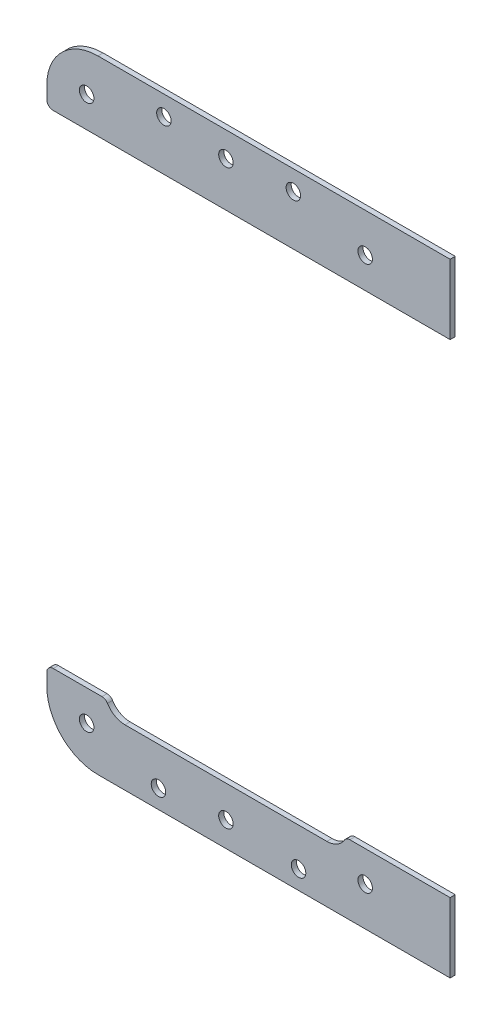
from build123d import *

# Parameters (mm, degrees)
SKETCH2_W            = 111.125
SKETCH2_H            = 193.04
BOSS_EXTRUDE1_DEPTH  = 1.5875
M4_CLEARANCE_HOLE1_D = 4.5
FILLET1_R            = 15.875
SKETCH6_R            = 2.4003
SKETCH6_R_2          = 3
SKETCH6_R_3          = 6.477
SKETCH6_R_4          = 10.762
CUT_EXTRUDE1_DEPTH   = 212.192646736
SKETCH7_W            = 13.97
SKETCH7_H            = 193.04
BOSS_EXTRUDE2_DEPTH  = 1.5875
SKETCH8_W            = 75.32443897
SKETCH8_H            = 38.1
SKETCH8_R            = 10.762
SKETCH8_R_2          = 3
SKETCH8_H_2          = 31.75
SKETCH8_H_3          = 34.487219484
SKETCH8_R_3          = 2.4003
SKETCH8_R_4          = 6.477
SKETCH8_R_5          = 8.9535
CUT_EXTRUDE2_DEPTH   = 1.5875
FILLET2_R            = 9.525
FILLET3_R            = 6.35
FILLET4_R            = 9.525
SKETCH9_W            = 125.095
SKETCH9_H            = 149.86
CUT_EXTRUDE5_DEPTH   = 80
FILLET6_R            = 2
FILLET8_R            = 2
FILLET9_R            = 2
FILLET10_R           = 2
SKETCH17_R           = 2.25
CUT_EXTRUDE12_DEPTH  = 72.5925
SKETCH18_R           = 2.25
BOSS_EXTRUDE9_DEPTH  = 1.5875
SKETCH20_R           = 2.25
CUT_EXTRUDE18_DEPTH  = 17.5875


with BuildPart() as part:
    # Sketch2 → Boss-Extrude1 (new body)
    with BuildSketch(Plane.XY.offset(-401.504104662)):
        with Locations((-6.650833159, 105.295051609)):
            Rectangle(SKETCH2_W, SKETCH2_H)
    extrude(amount=BOSS_EXTRUDE1_DEPTH)

    # M4 Clearance Hole1 (through all)
    with Locations(Plane.XY.offset(-399.916604662)):
        with Locations((36.540537091, 189.761421859), (-6.650833159, 194.079751609), (-49.842203409, 189.761421859), (-54.160533159, 133.489051609), (-54.160533159, 77.101051609), (-49.842203409, 20.82868136), (-6.650833159, 16.510351609), (36.540537091, 20.82868136), (40.858866841, 77.101051609), (40.858866841, 133.489051609), (14.260079544, 195.670051609), (-55.750833159, 105.295051609), (-27.561745863, 14.920051609)):
            Hole(M4_CLEARANCE_HOLE1_D / 2)

    # Fillet1
    fillet1_edges = [part.edges().sort_by_distance(p)[0] for p in [
        (-62.213333159, 201.815051609, -400.710354662),
        (-62.213333159, 8.775051609, -400.710354662),
    ]]
    fillet(fillet1_edges, radius=FILLET1_R)

    # Sketch6 → Cut-Extrude1 (cut, through all)
    with BuildSketch(Plane.XY.offset(-399.916604662)):
        with Locations((-34.590833159, 43.382551609)):
            Circle(SKETCH6_R)
        with Locations((21.289166841, 43.382551609)):
            Circle(SKETCH6_R)
        with Locations((-20.884724927, 142.590766631)):
            Circle(SKETCH6_R_2)
        with Locations((7.583058609, 166.225175879)):
            Circle(SKETCH6_R_2)
        with Locations((3.509166841, 43.382551609)):
            Circle(SKETCH6_R_3)
        with Locations((-16.810833159, 43.382551609)):
            Circle(SKETCH6_R_3)
        with Locations((-33.320833159, 123.670051609)):
            Circle(SKETCH6_R_3)
        with Locations((-6.650833159, 154.407971255)):
            Circle(SKETCH6_R_4)
        with Locations((-6.650833159, 94.607131964)):
            Circle(SKETCH6_R_4)
    extrude(amount=-CUT_EXTRUDE1_DEPTH, mode=Mode.SUBTRACT)

    # Sketch7 → Boss-Extrude2 (add)
    with BuildSketch(Plane.XY.offset(-399.916604662)):
        with Locations((55.896666841, 105.295051609)):
            Rectangle(SKETCH7_W, SKETCH7_H)
    extrude(amount=-BOSS_EXTRUDE2_DEPTH)

    # Sketch8 → Cut-Extrude2 (cut)
    # profile 1 of 4: a face of its own
    with BuildSketch(Plane.XY.offset(-399.916604662)):
        with Locations((-6.650833159, 154.407971255)):
            Rectangle(SKETCH8_W, SKETCH8_H)
        with Locations((-6.650833159, 154.407971255)):
            Circle(SKETCH8_R, mode=Mode.SUBTRACT)
        with Locations((7.583058609, 166.225175879)):
            Circle(SKETCH8_R_2, mode=Mode.SUBTRACT)
        with Locations((-20.884724927, 142.590766631)):
            Circle(SKETCH8_R_2, mode=Mode.SUBTRACT)
    # profile 2 of 4: a face of its own
    with BuildSketch(Plane.XY.offset(-399.916604662)):
        with Locations((-6.650833159, 94.607131964)):
            Rectangle(SKETCH8_W, SKETCH8_H_2)
        with Locations((-6.650833159, 94.607131964)):
            Circle(SKETCH8_R, mode=Mode.SUBTRACT)
    # profile 3 of 4: a face of its own
    with BuildSketch(Plane.XY.offset(-399.916604662)):
        with Locations((-6.650833159, 43.601441867)):
            Rectangle(SKETCH8_W, SKETCH8_H_3)
        with Locations((-34.590833159, 43.382551609)):
            Circle(SKETCH8_R_3, mode=Mode.SUBTRACT)
        with Locations((-16.810833159, 43.382551609)):
            Circle(SKETCH8_R_4, mode=Mode.SUBTRACT)
        with Locations((3.509166841, 43.382551609)):
            Circle(SKETCH8_R_4, mode=Mode.SUBTRACT)
        with Locations((21.289166841, 43.382551609)):
            Circle(SKETCH8_R_3, mode=Mode.SUBTRACT)
    # profile 4 of 4: a face of its own
    with BuildSketch(Plane.XY.offset(-399.916604662)):
        with Locations((-33.320833159, 123.670051609)):
            Circle(SKETCH8_R_5)
        with Locations((-33.320833159, 123.670051609)):
            Circle(SKETCH8_R_4, mode=Mode.SUBTRACT)
    extrude(amount=-CUT_EXTRUDE2_DEPTH, mode=Mode.SUBTRACT)

    # Fillet2
    fillet2_edges = [part.edges().sort_by_distance(p)[0] for p in [
        (-44.313052644, 173.457971255, -400.710354662),
        (-44.313052644, 135.357971255, -400.710354662),
        (31.011386326, 135.357971255, -400.710354662),
        (31.011386326, 173.457971255, -400.710354662),
    ]]
    fillet(fillet2_edges, radius=FILLET2_R)

    # Fillet3
    fillet3_edges = [part.edges().sort_by_distance(p)[0] for p in [
        (-44.313052644, 26.357832125, -400.710354662),
        (31.011386326, 26.357832125, -400.710354662),
        (31.011386326, 60.845051609, -400.710354662),
        (-44.313052644, 60.845051609, -400.710354662),
    ]]
    fillet(fillet3_edges, radius=FILLET3_R)

    # Fillet4
    fillet4_edges = [part.edges().sort_by_distance(p)[0] for p in [
        (-44.313052644, 110.482131964, -400.710354662),
        (-44.313052644, 78.732131964, -400.710354662),
        (31.011386326, 78.732131964, -400.710354662),
        (31.011386326, 110.482131964, -400.710354662),
    ]]
    fillet(fillet4_edges, radius=FILLET4_R)

    # Sketch9 → Cut-Extrude5 (cut)
    with BuildSketch(Plane.XY.offset(-399.916604662)):
        with Locations((0.334166841, 105.295051609)):
            Rectangle(SKETCH9_W, SKETCH9_H)
    extrude(amount=-CUT_EXTRUDE5_DEPTH, mode=Mode.SUBTRACT)


with BuildPart() as cut_extrude5_piece_1:
    # of the separate pieces the step leaves, piece 1, a body of its own (cut_extrude5_pieces)
    add(part.part.solids().sort_by_distance((-62.213333159, 180.225051609, -401.504104662))[0])

    # Fillet10
    fillet10_edges = [cut_extrude5_piece_1.edges().sort_by_distance(p)[0] for p in [
        (-62.213333159, 180.225051609, -400.710354662),
    ]]
    fillet(fillet10_edges, radius=FILLET10_R)


with BuildPart() as cut_extrude5_piece_2:
    # of the separate pieces the step leaves, piece 2, a body of its own (cut_extrude5_pieces)
    add(part.part.solids().sort_by_distance((62.881666841, 30.365051609, -401.504104662))[0])

    # Fillet6
    fillet6_edges = [cut_extrude5_piece_2.edges().sort_by_distance(p)[0] for p in [
        (-62.213333159, 30.365051609, -400.710354662),
    ]]
    fillet(fillet6_edges, radius=FILLET6_R)

    # Fillet8
    fillet8_edges = [cut_extrude5_piece_2.edges().sort_by_distance(p)[0] for p in [
        (-43.86507598, 30.365051609, -400.710354662),
    ]]
    fillet(fillet8_edges, radius=FILLET8_R)

    # Fillet9
    fillet9_edges = [cut_extrude5_piece_2.edges().sort_by_distance(p)[0] for p in [
        (30.563409662, 30.365051609, -400.710354662),
    ]]
    fillet(fillet9_edges, radius=FILLET9_R)

    # Sketch17 → Cut-Extrude12 (cut)
    with BuildSketch(Plane(origin=(0, 0, -401.504104662), x_dir=(-1, 0, 0), z_dir=(0, 0, -1))):
        with Locations((-15.869025161, 14.55469533)):
            Circle(SKETCH17_R)
    extrude(amount=-CUT_EXTRUDE12_DEPTH, mode=Mode.SUBTRACT)

    # Sketch18 → Boss-Extrude9 (add)
    with BuildSketch(Plane(origin=(0, 0, -401.504104662), x_dir=(-1, 0, 0), z_dir=(0, 0, -1))):
        with Locations((27.561745863, 14.920051609)):
            Circle(SKETCH18_R)
    extrude(amount=-BOSS_EXTRUDE9_DEPTH)


with BuildPart() as cut_extrude18_tool:
    # Sketch20 → Cut-Extrude18 (new body)
    with BuildSketch(Plane(origin=(0, 0, -401.504104662), x_dir=(-1, 0, 0), z_dir=(0, 0, -1))):
        with Locations((27.564974839, 14.55469533)):
            Circle(SKETCH20_R)
        with Locations((25.871920456, 195.670051609)):
            Circle(SKETCH20_R)
    extrude(amount=-CUT_EXTRUDE18_DEPTH)


with BuildPart() as cut_extrude5_piece_1_1:
    add(cut_extrude5_piece_1.part)

    # Cut-Extrude18: cut by cut_extrude18_tool
    add(cut_extrude18_tool.part, mode=Mode.SUBTRACT)


with BuildPart() as cut_extrude5_piece_2_1:
    add(cut_extrude5_piece_2.part)

    # Cut-Extrude18: cut by cut_extrude18_tool
    add(cut_extrude18_tool.part, mode=Mode.SUBTRACT)


solid = Compound([cut_extrude5_piece_1_1.part, cut_extrude5_piece_2_1.part])
